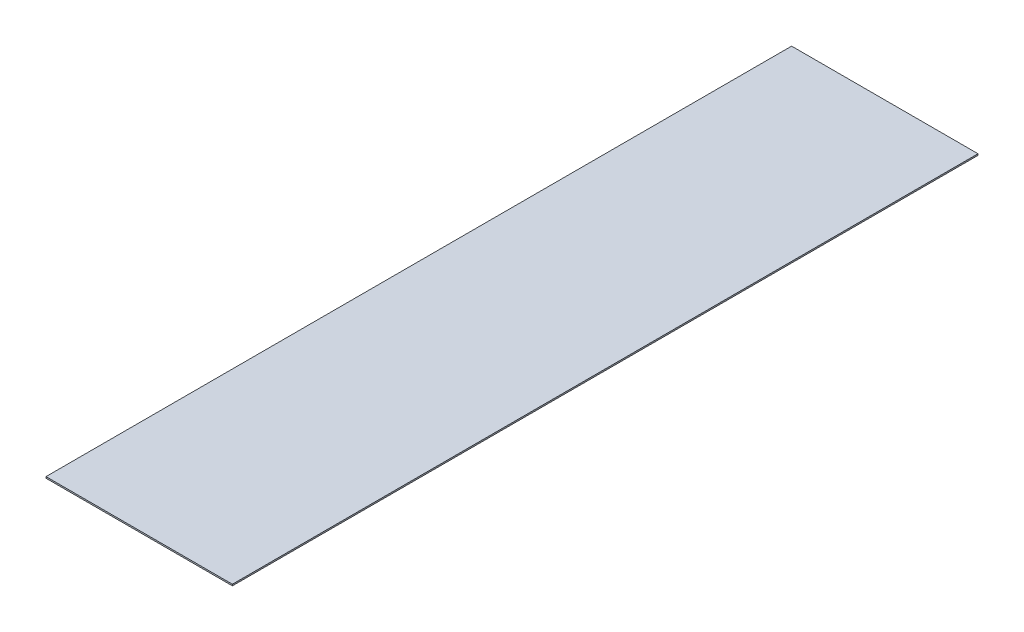
from build123d import *

# Parameters (mm, degrees)
SKETCH1_W           = 127
SKETCH1_H           = 1
BOSS_EXTRUDE1_DEPTH = 508


with BuildPart() as part:
    # Sketch1 → Boss-Extrude1 (new body)
    with BuildSketch(Plane.XY):
        Rectangle(SKETCH1_W, SKETCH1_H)
    extrude(amount=-BOSS_EXTRUDE1_DEPTH)


solid = part.part
